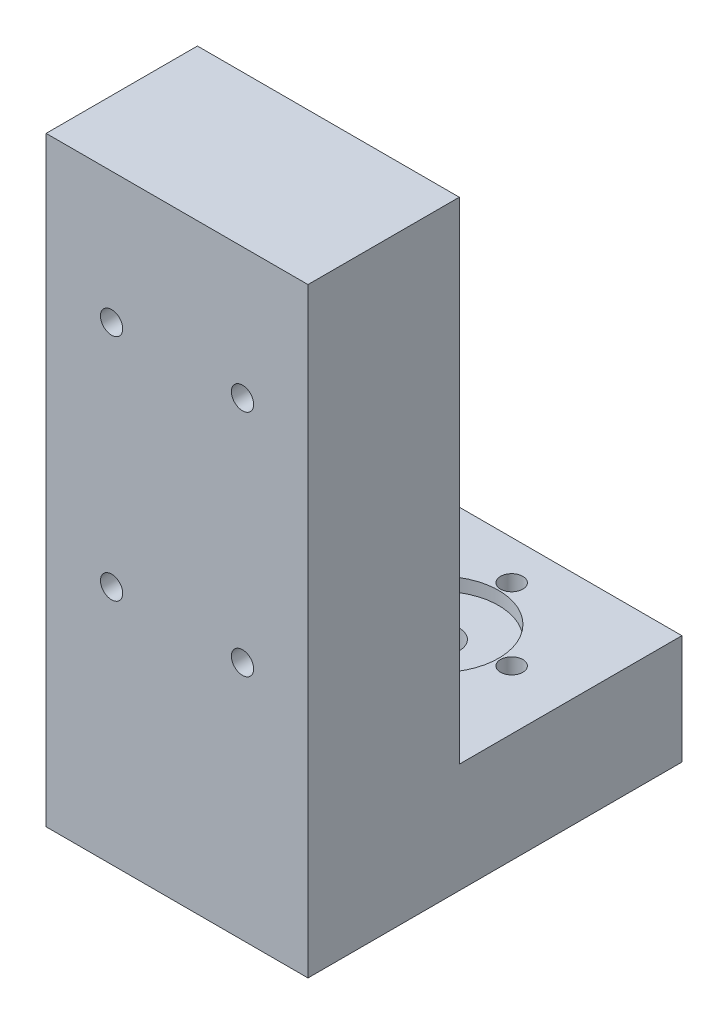
from build123d import *

# Parameters (mm, degrees)
BOSS_EXTRUDE1_DEPTH  = 20
CUT_EXTRUDE2_START   = -16.729038
SKETCH3_R            = 3
CUT_EXTRUDE2_DEPTH   = 16.729038
SKETCH2_R            = 9
CUT_EXTRUDE1_DEPTH   = 2
SKETCH5_R            = 1.7
CUT_EXTRUDE3_DEPTH   = 16.729037413
CIRPATTERN1_COUNT    = 4
SKETCH6_R            = 1.7
CUT_EXTRUDE4_DEPTH   = 23.112367583
LPATTERN1_COUNT      = 2
LPATTERN1_PITCH      = 20
LPATTERN1_COUNT_DIR2 = 2
LPATTERN1_PITCH_DIR2 = 35


with BuildPart() as part:
    # Sketch1 → Boss-Extrude1 (new, symmetric)
    with BuildSketch(Plane(origin=(0, 0, 0), x_dir=(0, 0, -1), z_dir=(1, 0, 0))):
        Polygon((0, 0), (34, 0), (34, -16.729037413), (-23.112367583, -16.729037413), (-23.112367583, 75), (0, 75), align=None)
    extrude(amount=BOSS_EXTRUDE1_DEPTH, both=True)

    # Sketch3 → Cut-Extrude2 (cut)
    with BuildSketch(Plane(origin=(0, 0, 0), x_dir=(1, 0, 0), z_dir=(0, 1, 0)).offset(CUT_EXTRUDE2_START)):
        with Locations(Location((0, 17, 0), (0, 0, 270))):
            Circle(SKETCH3_R)
    extrude(amount=CUT_EXTRUDE2_DEPTH, mode=Mode.SUBTRACT)

    # Sketch2 → Cut-Extrude1 (cut)
    with BuildSketch(Plane(origin=(0, 0, 0), x_dir=(1, 0, 0), z_dir=(0, 1, 0))):
        with Locations(Location((0, 17, 0), (0, 0, 270))):
            Circle(SKETCH2_R)
    extrude(amount=-CUT_EXTRUDE1_DEPTH, mode=Mode.SUBTRACT)

    # Sketch5 → Cut-Extrude3 (cut)
    with BuildSketch(Plane(origin=(0, 0, 0), x_dir=(1, 0, 0), z_dir=(0, 1, 0))):
        with Locations(Location((0, 28, 0), (0, 0, 270))):
            Circle(SKETCH5_R)
    cut_extrude3 = extrude(amount=-CUT_EXTRUDE3_DEPTH, mode=Mode.SUBTRACT)

    # CirPattern1: Cut-Extrude3 ×4 about axis
    cirpattern1_axis = Axis((0, 0, -17), (0, 1, 0))
    for i in range(1, CIRPATTERN1_COUNT):
        add(cut_extrude3.rotate(cirpattern1_axis, i * 360 / CIRPATTERN1_COUNT), mode=Mode.SUBTRACT)

    # Sketch6 → Cut-Extrude4 (cut)
    with BuildSketch(Plane(origin=(0, 0, 0), x_dir=(-1, 0, 0), z_dir=(0, 0, -1))):
        with Locations(Location((10, 55, 0), (0, 0, 90))):
            Circle(SKETCH6_R)
    cut_extrude4 = extrude(amount=-CUT_EXTRUDE4_DEPTH, mode=Mode.SUBTRACT)

    # LPattern1: Cut-Extrude4 2 × 2
    with Locations(*[(i * LPATTERN1_PITCH, -j * LPATTERN1_PITCH_DIR2, 0) for i in range(LPATTERN1_COUNT) for j in range(LPATTERN1_COUNT_DIR2) if (i, j) != (0, 0)]):
        add(cut_extrude4, mode=Mode.SUBTRACT)


solid = part.part
